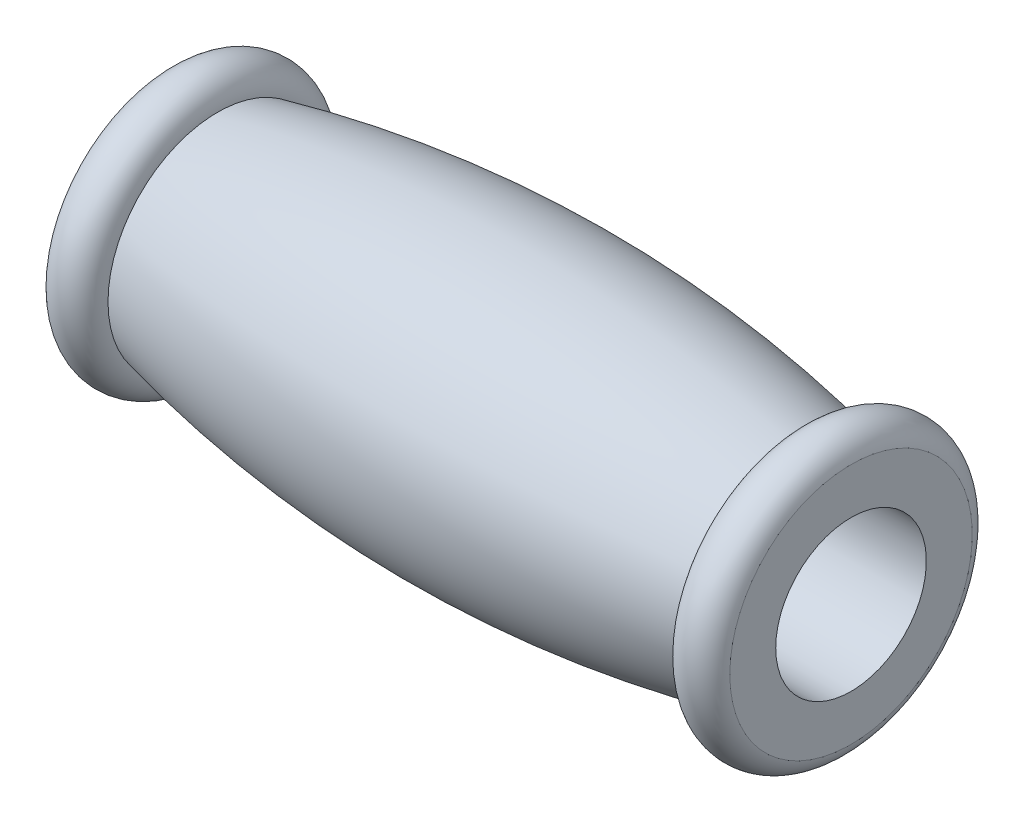
from build123d import *


with BuildPart() as part:
    # Sketch1 → Revolve1 (revolve)
    with BuildSketch(Plane.XY, mode=Mode.PRIVATE) as revolve1_sk:
        with BuildLine():
            Line((-50, 11), (50, 11))
            Line((50, 11), (50, 17.7))
            ThreePointArc((50, 17.7), (45.4, 20.6), (42.5, 16))
            ThreePointArc((42.5, 16), (0, 20.829313385), (-42.5, 16))
            ThreePointArc((-42.5, 16), (-46.25, 19.75), (-50, 16))
            Line((-50, 16), (-50, 11))
        make_face()
    revolve(revolve1_sk.sketch.rotate(Axis((-100, 0, 0), (1, 0, 0)), 90), axis=Axis((-100, 0, 0), (1, 0, 0)))


solid = part.part
